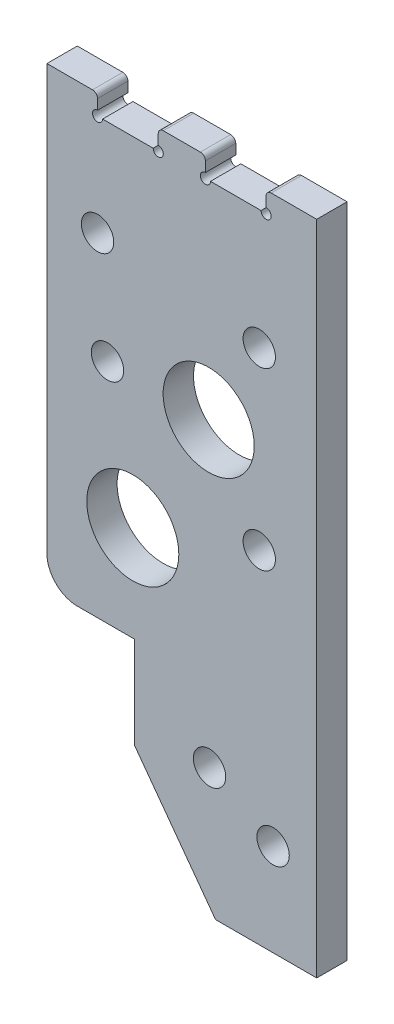
from build123d import *

# Parameters (mm, degrees)
SKETCH1_R           = 1.6
BOSS_EXTRUDE1_DEPTH = 3
SKETCH2_W           = 26.662281872
SKETCH2_H           = 42
BOSS_EXTRUDE2_DEPTH = 3
FILLET1_R           = 3
SKETCH4_R           = 4.55
CUT_EXTRUDE1_DEPTH  = 10
SKETCH5_W           = 26.662281872
SKETCH5_H           = 5
CUT_EXTRUDE2_DEPTH  = 26.41
SKETCH7_R           = 4.5
CUT_EXTRUDE4_DEPTH  = 26.41
SKETCH8_R           = 1.6
CUT_EXTRUDE5_DEPTH  = 10
SKETCH10_R          = 1.6
CUT_EXTRUDE6_DEPTH  = 10
SKETCH10_3_W        = 26.662281872
SKETCH10_3_H        = 7.941029608
BOSS_EXTRUDE3_DEPTH = 3
SKETCH12_W          = 6
SKETCH12_H          = 2
CUT_EXTRUDE7_DEPTH  = 3
SKETCH13_R          = 0.5
CUT_EXTRUDE8_DEPTH  = 10
FILLET3_R           = 0.5


with BuildPart() as part:
    # Sketch1 → Boss-Extrude1 (new body)
    with BuildSketch(Plane.XY):
        Polygon((21.662281872, 13.095004603), (3.662281872, 13.095004603), (3.662281872, 3.996411484), (11.662281872, -6.904995397), (21.662281872, -6.904995397), align=None)
        with Locations((17.350706117, 2.224156973)):
            Circle(SKETCH1_R, mode=Mode.SUBTRACT)
        with Locations((11.071923485, 5.808644396)):
            Circle(SKETCH1_R, mode=Mode.SUBTRACT)
    extrude(amount=BOSS_EXTRUDE1_DEPTH)

    # Sketch2 → Boss-Extrude2 (add)
    with BuildSketch(Plane.XY.offset(3)):
        with Locations((8.331140936, 34.095004603)):
            Rectangle(SKETCH2_W, SKETCH2_H)
    extrude(amount=-BOSS_EXTRUDE2_DEPTH)

    # Fillet1
    fillet1_edges = [part.edges().sort_by_distance(p)[0] for p in [
        (-5, 13.095004603, 1.5),
    ]]
    fillet(fillet1_edges, radius=FILLET1_R)

    # Sketch4 → Cut-Extrude1 (cut)
    with BuildSketch(Plane.XY.offset(3)):
        with Locations((3.484643759, 22.541949523)):
            Circle(SKETCH4_R)
    extrude(amount=-CUT_EXTRUDE1_DEPTH, mode=Mode.SUBTRACT)

    # Sketch5 → Cut-Extrude2 (cut)
    with BuildSketch(Plane.XY.offset(3)):
        with Locations((8.331140936, 52.595004603)):
            Rectangle(SKETCH5_W, SKETCH5_H)
    extrude(amount=-CUT_EXTRUDE2_DEPTH, mode=Mode.SUBTRACT)

    # Sketch7 → Cut-Extrude4 (cut)
    with BuildSketch(Plane.XY.offset(3)):
        with Locations((10.984643759, 35.53233058)):
            Circle(SKETCH7_R)
    extrude(amount=-CUT_EXTRUDE4_DEPTH, mode=Mode.SUBTRACT)

    # Sketch8 → Cut-Extrude5 (cut)
    with BuildSketch(Plane.XY.offset(3)):
        with Locations((15.984643759, 26.872076542)):
            Circle(SKETCH8_R)
        with Locations((15.984643759, 44.192584618)):
            Circle(SKETCH8_R)
        with Locations((0.984643759, 35.53233058)):
            Circle(SKETCH8_R)
    extrude(amount=-CUT_EXTRUDE5_DEPTH, mode=Mode.SUBTRACT)

    # Sketch10 → Cut-Extrude6 (cut)
    with BuildSketch(Plane.XY.offset(3)):
        with Locations((0, 46.036034211)):
            Circle(SKETCH10_R)
    extrude(amount=-CUT_EXTRUDE6_DEPTH, mode=Mode.SUBTRACT)

    # Sketch10<3> → Boss-Extrude3 (add)
    with BuildSketch(Plane.XY.offset(3)):
        with Locations((8.331140936, 54.065519407)):
            Rectangle(SKETCH10_3_W, SKETCH10_3_H)
    extrude(amount=-BOSS_EXTRUDE3_DEPTH)

    # Sketch12 → Cut-Extrude7 (cut)
    with BuildSketch(Plane.XY.offset(3)):
        with Locations((3, 57.036034211)):
            Rectangle(SKETCH12_W, SKETCH12_H)
        with Locations((13.662281872, 57.036034211)):
            Rectangle(SKETCH12_W, SKETCH12_H)
    extrude(amount=-CUT_EXTRUDE7_DEPTH, mode=Mode.SUBTRACT)

    # Sketch13 → Cut-Extrude8 (cut)
    with BuildSketch(Plane.XY.offset(3)):
        with Locations((0, 56.036034211)):
            Circle(SKETCH13_R)
        with Locations((6, 56.036034211)):
            Circle(SKETCH13_R)
        with Locations((10.662281872, 56.036034211)):
            Circle(SKETCH13_R)
        with Locations((16.662281872, 56.036034211)):
            Circle(SKETCH13_R)
    extrude(amount=-CUT_EXTRUDE8_DEPTH, mode=Mode.SUBTRACT)

    # Fillet3
    fillet3_edges = [part.edges().sort_by_distance(p)[0] for p in [
        (16.662281872, 58.036034211, 1.5),
        (10.662281872, 58.036034211, 1.5),
        (6, 58.036034211, 1.5),
        (0, 58.036034211, 1.5),
    ]]
    fillet(fillet3_edges, radius=FILLET3_R)


solid = part.part
